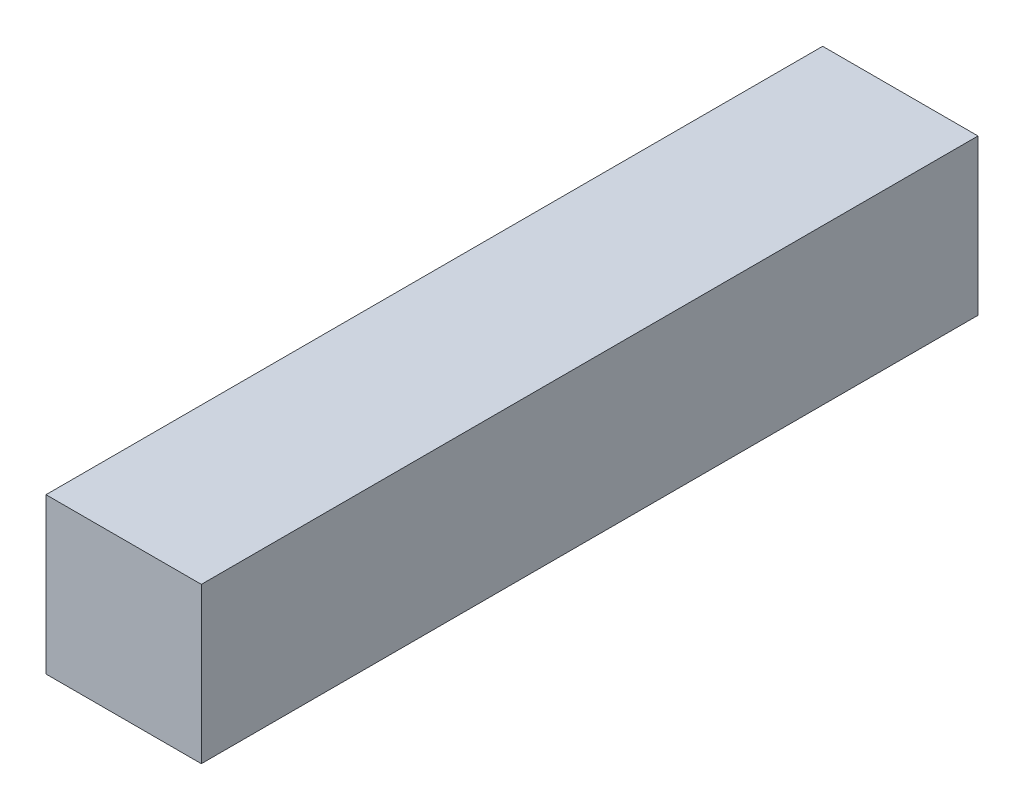
from build123d import *

# Parameters (mm, degrees)
SKETCH1_W           = 3
SKETCH1_H           = 3
BOSS_EXTRUDE1_DEPTH = 15


with BuildPart() as part:
    # Sketch1 → Boss-Extrude1 (new body)
    with BuildSketch(Plane.XY):
        with Locations((1.5, 1.5)):
            Rectangle(SKETCH1_W, SKETCH1_H)
    extrude(amount=BOSS_EXTRUDE1_DEPTH)


solid = part.part
